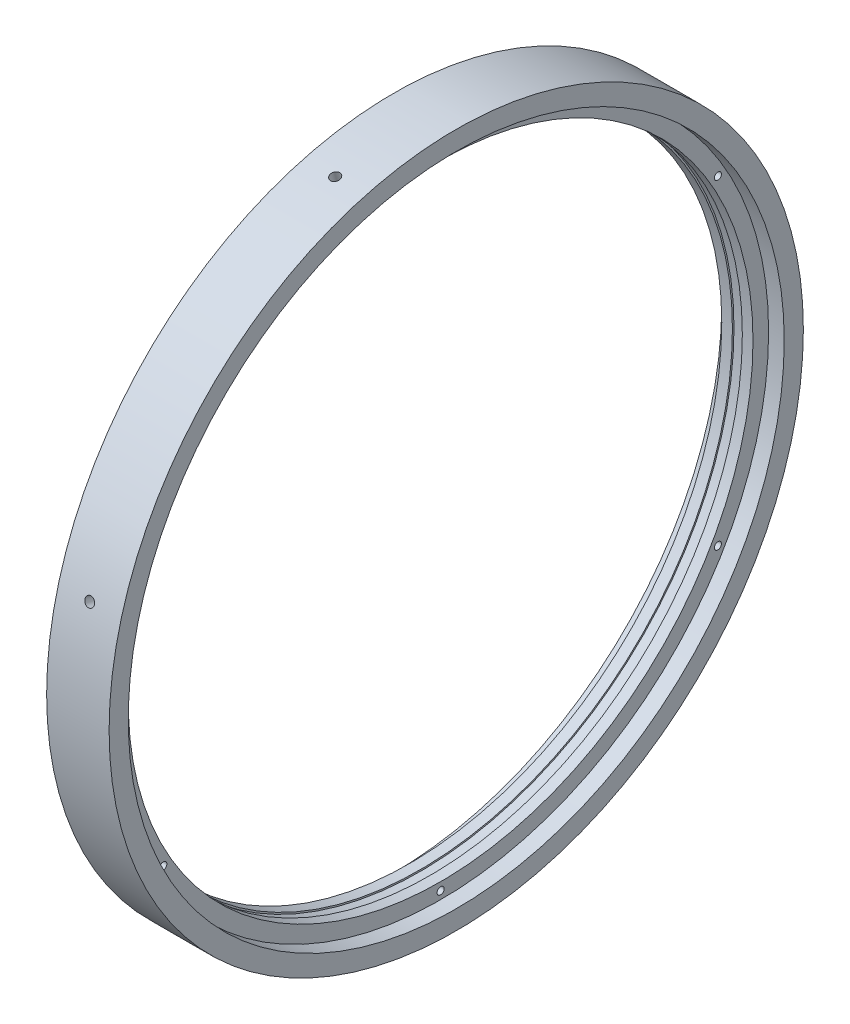
from build123d import *

# Parameters (mm, degrees)
TAP_DRILL_FOR_4_40_TAP2_D     = 2.2606
TAP_DRILL_FOR_4_40_TAP2_DEPTH = 8.89
TAP_DRILL_FOR_4_40_TAP2_TIP   = 0.679152758
TAP_DRILL_FOR_4_40_TAP3_D     = 2.2606
TAP_DRILL_FOR_4_40_TAP3_DEPTH = 8.89
TAP_DRILL_FOR_4_40_TAP3_TIP   = 0.679152758
SKETCH9_R                     = 1.524
CUT_EXTRUDE1_DEPTH            = 8.89
CIRPATTERN1_COUNT             = 6
TAP_DRILL_FOR_4_40_TAP1_D     = 2.2606
TAP_DRILL_FOR_4_40_TAP1_DEPTH = 6.35
TAP_DRILL_FOR_4_40_TAP1_TIP   = 0.679152758


with BuildPart() as part:
    # Sketch3 → Revolve1 (revolve)
    with BuildSketch(Plane(origin=(0, 0, 0), x_dir=(1, 0, 0), z_dir=(0, 1, 0))):
        Polygon((-10, -111.125), (10, -111.125), (10, -105), (5, -105), (5, -100), (1.5875, -100), (1.5875, -100.5), (-1.5875, -100.5), (-1.5875, -100), (-5, -100), (-5, -105), (-10, -105), align=None)
    revolve(axis=Axis((0, 0, 0), (-1, 0, 0)))

    # Tap Drill for #4-40 Tap2
    with Locations(Plane(origin=(5, -102.5, 0), x_dir=(0, 0, 1), z_dir=(1, 0, 0))):
        with Locations((0, 0), (-88.767603888, -51.25), (88.767603888, -51.25), (88.767603888, -153.75), (0, -205), (-88.767603888, -153.75)):
            Hole(TAP_DRILL_FOR_4_40_TAP2_D / 2, depth=TAP_DRILL_FOR_4_40_TAP2_DEPTH)
            with Locations((0, 0, -(TAP_DRILL_FOR_4_40_TAP2_DEPTH + TAP_DRILL_FOR_4_40_TAP2_TIP / 2))):  # 118° drill point
                Cone(0, TAP_DRILL_FOR_4_40_TAP2_D / 2, TAP_DRILL_FOR_4_40_TAP2_TIP, mode=Mode.SUBTRACT)

    # Tap Drill for #4-40 Tap3
    with Locations(Plane(origin=(-5, -88.767603888, 51.25), x_dir=(0, 0, -1), z_dir=(-1, 0, 0))):
        with Locations((0, 0), (-51.25, -88.767603888), (102.5, -177.535207776), (0, -177.535207776), (153.75, -88.767603888), (102.5, 0)):
            Hole(TAP_DRILL_FOR_4_40_TAP3_D / 2, depth=TAP_DRILL_FOR_4_40_TAP3_DEPTH)
            with Locations((0, 0, -(TAP_DRILL_FOR_4_40_TAP3_DEPTH + TAP_DRILL_FOR_4_40_TAP3_TIP / 2))):  # 118° drill point
                Cone(0, TAP_DRILL_FOR_4_40_TAP3_D / 2, TAP_DRILL_FOR_4_40_TAP3_TIP, mode=Mode.SUBTRACT)

    # Sketch9 → Cut-Extrude1 (cut)
    with BuildSketch(Plane(origin=(0, 107.338507446, 28.761266387), x_dir=(-1, 0, 0), z_dir=(0, 0.9659258262890681, 0.25881904510252135))):
        Circle(SKETCH9_R)
    cut_extrude1 = extrude(amount=-CUT_EXTRUDE1_DEPTH, mode=Mode.SUBTRACT)

    # CirPattern1: Cut-Extrude1 ×6 about axis
    cirpattern1_axis = Axis((-10, 0, 0), (1, 0, 0))
    for i in range(1, CIRPATTERN1_COUNT):
        add(cut_extrude1.rotate(cirpattern1_axis, i * 360 / CIRPATTERN1_COUNT), mode=Mode.SUBTRACT)

    # Tap Drill for #4-40 Tap1
    with Locations(Plane(origin=(-10, 108.0625, 0), x_dir=(0, 0, -1), z_dir=(-1, 0, 0))):
        with Locations((0, 0), (-93.584870196, 54.03125), (-93.584870196, 162.09375), (0, 216.125), (93.584870196, 162.09375), (93.584870196, 54.03125)):
            Hole(TAP_DRILL_FOR_4_40_TAP1_D / 2, depth=TAP_DRILL_FOR_4_40_TAP1_DEPTH)
            with Locations((0, 0, -(TAP_DRILL_FOR_4_40_TAP1_DEPTH + TAP_DRILL_FOR_4_40_TAP1_TIP / 2))):  # 118° drill point
                Cone(0, TAP_DRILL_FOR_4_40_TAP1_D / 2, TAP_DRILL_FOR_4_40_TAP1_TIP, mode=Mode.SUBTRACT)


solid = part.part
